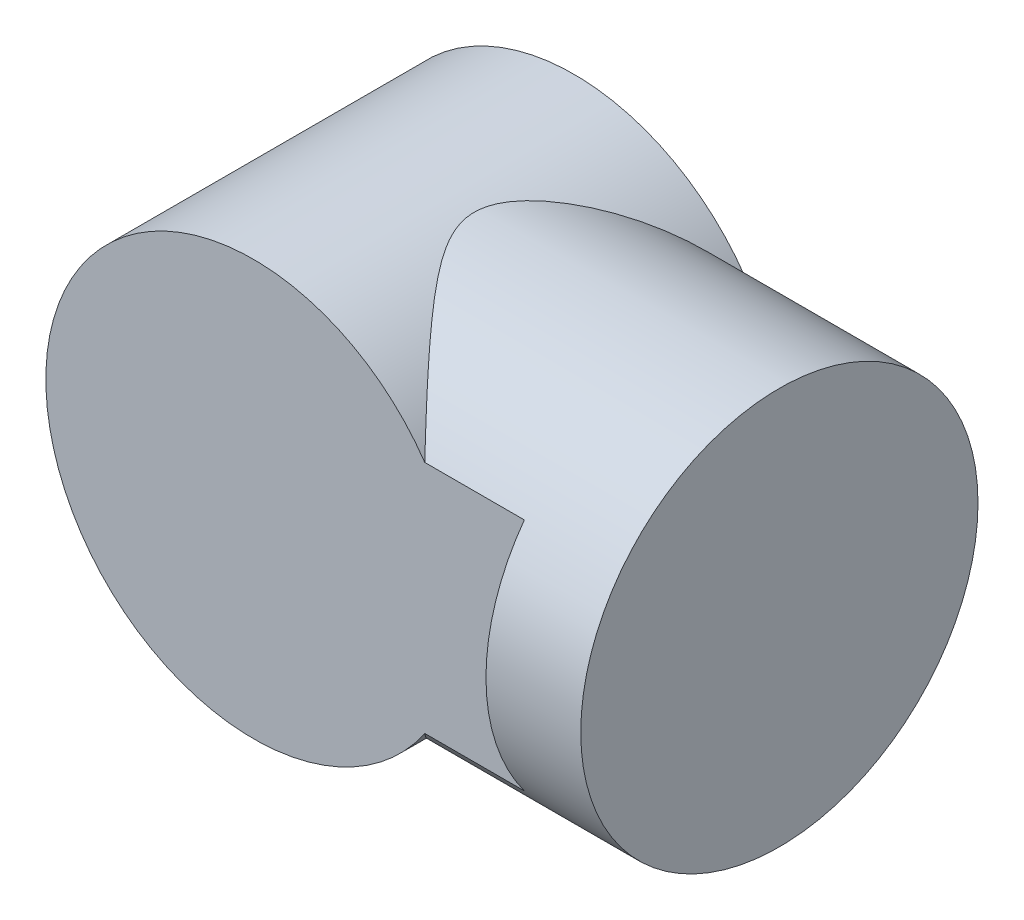
from build123d import *

# Parameters (mm, degrees)
SKETCH_1_R           = 46
EXTRUDE_1_DEPTH      = 35.5
EXTRUDE_2_REACH      = 141.661
EXTRUDE_2_END_RADIUS = 46
SKETCH_2_R           = 44
SKETCH_3_W           = 10.337073316
SKETCH_3_H           = 61.617049376
SKETCH_3_W_2         = 11.195847523
CUT_EXTRUDE_1_DEPTH  = 60


with BuildPart() as part:
    # 草图1 → 凸台-拉伸1 (new, symmetric)
    with BuildSketch(Plane.XY):
        Circle(SKETCH_1_R)
    extrude(amount=EXTRUDE_1_DEPTH, both=True)

    # 凸台-拉伸2: up to this cylinder (the profile starts outside it)
    extrude_2_end = Plane(origin=(0, 0, 0), z_dir=(0, 0, -1)) * Cylinder(EXTRUDE_2_END_RADIUS, 376.322, mode=Mode.PRIVATE)
    # 草图2 → 凸台-拉伸2 (add, up to the surface)
    with BuildSketch(Plane(origin=(81, 0, 0), x_dir=(0, 0, -1), z_dir=(1, 0, 0)), mode=Mode.PRIVATE) as extrude_2_sk1:
        Circle(SKETCH_2_R)
    extrude_2_tool1 = extrude(extrude_2_sk1.sketch, amount=-EXTRUDE_2_REACH, mode=Mode.PRIVATE) - extrude_2_end
    add(extrude_2_tool1.solids().sort_by_distance((81, 0, 0))[0])

    # 草图3 → 切除-拉伸1 (cut)
    with BuildSketch(Plane(origin=(0, 0, 0), x_dir=(0, 0, -1), z_dir=(1, 0, 0))):
        with Locations((-40.668536658, 1.610201639)):
            Rectangle(SKETCH_3_W, SKETCH_3_H)
        with Locations((41.097923761, 1.610201639)):
            Rectangle(SKETCH_3_W_2, SKETCH_3_H)
    extrude(amount=CUT_EXTRUDE_1_DEPTH, mode=Mode.SUBTRACT)


solid = part.part
